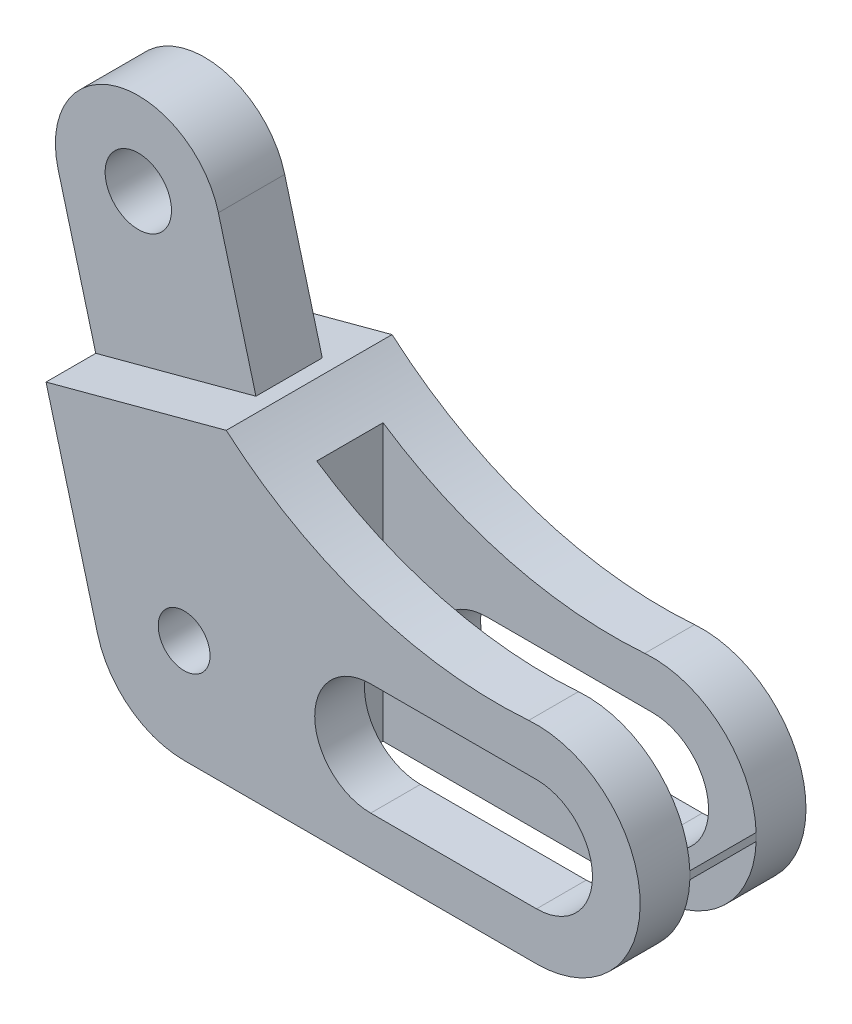
from build123d import *

# Parameters (mm, degrees)
SKETCH1_R           = 6.25
BOSS_EXTRUDE1_DEPTH = 20
SKETCH2_R           = 8
BOSS_EXTRUDE2_DEPTH = 8
SKETCH3_W           = 16
SKETCH3_H           = 332.488311808
CUT_EXTRUDE1_DEPTH  = 90


with BuildPart() as part:
    # Sketch1 → Boss-Extrude1 (new, symmetric)
    with BuildSketch(Plane.XY):
        with BuildLine():
            Line((0, -25), (85, -25))
            ThreePointArc((85, -25), (109.985084644, 0.943739672), (83.11944661, 24.934770827))
            ThreePointArc((83.11944661, 24.934770827), (44.228399081, 29.699192353), (10.153265793, 49.040820564))
            Line((10.153265793, 49.040820564), (-33.31339639, 37.393963534))
            Line((-33.31339639, 37.393963534), (-20.890082225, -8.970476128))
            ThreePointArc((-20.890082225, -8.970476128), (-13.165686186, -20.530851753), (0, -25))
        make_face()
        Circle(SKETCH1_R, mode=Mode.SUBTRACT)
        with BuildLine():
            Line((85.000943792, -13.497203546), (45.00094389, -13.499999967))
            ThreePointArc((45.00094389, -13.499999967), (31.500000131, -0.000943792), (44.999056306, 13.499999967))
            Line((44.999056306, 13.499999967), (84.999056208, 13.502796388))
            ThreePointArc((84.999056208, 13.502796388), (98.499999967, 0.003740213), (85.000943792, -13.497203546))
        make_face(mode=Mode.SUBTRACT)
    extrude(amount=BOSS_EXTRUDE1_DEPTH, both=True)

    # Sketch2 → Boss-Extrude2 (add, symmetric)
    with BuildSketch(Plane.XY):
        with BuildLine():
            Line((-33.31339639, 37.393963534), (-42.372062969, 71.201367454))
            ThreePointArc((-42.372062969, 71.201367454), (-28.229927345, 95.696264882), (-3.735029917, 81.554129259))
            Line((-3.735029917, 81.554129259), (5.323636662, 47.746725338))
            Line((5.323636662, 47.746725338), (-33.31339639, 37.393963534))
        make_face()
        with Locations((-23.053546443, 76.377748356)):
            Circle(SKETCH2_R, mode=Mode.SUBTRACT)
    extrude(amount=BOSS_EXTRUDE2_DEPTH, both=True)

    # Sketch3 → Cut-Extrude1 (cut)
    with BuildSketch(Plane(origin=(109.985084644, 0, 0), x_dir=(0, 0, -1), z_dir=(1, 0, 0))):
        with Locations((0, -25)):
            Rectangle(SKETCH3_W, SKETCH3_H)
    extrude(amount=-CUT_EXTRUDE1_DEPTH, mode=Mode.SUBTRACT)


solid = part.part
